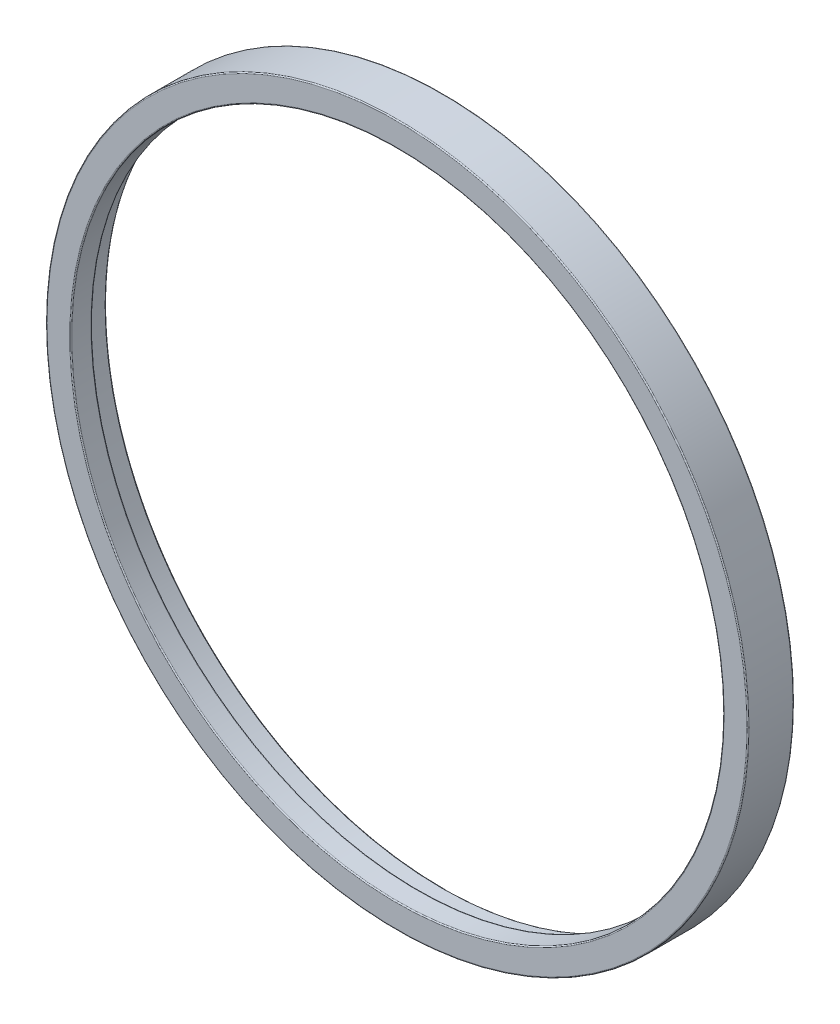
from build123d import *


with BuildPart() as part:
    # Sketch1 → Revolve1 (revolve)
    with BuildSketch(Plane(origin=(0, 0, 0), x_dir=(0, 0, -1), z_dir=(1, 0, 0)), mode=Mode.PRIVATE) as revolve1_sk:
        with BuildLine():
            Line((0.15, 46), (2.85, 46))
            ThreePointArc((2.85, 46), (2.956066017, 46.043933983), (3, 46.15))
            Line((3, 46.15), (3, 47.35))
            ThreePointArc((3, 47.35), (3.043933983, 47.456066017), (3.15, 47.5))
            Line((3.15, 47.5), (6.35, 47.5))
            ThreePointArc((6.35, 47.5), (6.456066017, 47.543933983), (6.5, 47.65))
            Line((6.5, 47.65), (6.5, 49.35))
            ThreePointArc((6.5, 49.35), (6.456066017, 49.456066017), (6.35, 49.5))
            Line((6.35, 49.5), (0.15, 49.5))
            ThreePointArc((0.15, 49.5), (0.043933983, 49.456066017), (0, 49.35))
            Line((0, 49.35), (0, 46.15))
            ThreePointArc((0, 46.15), (0.043933983, 46.043933983), (0.15, 46))
        make_face()
    revolve(revolve1_sk.sketch.rotate(Axis((0, 0, 28.179176755), (0, 0, -1)), 90), axis=Axis((0, 0, 28.179176755), (0, 0, -1)))


solid = part.part
